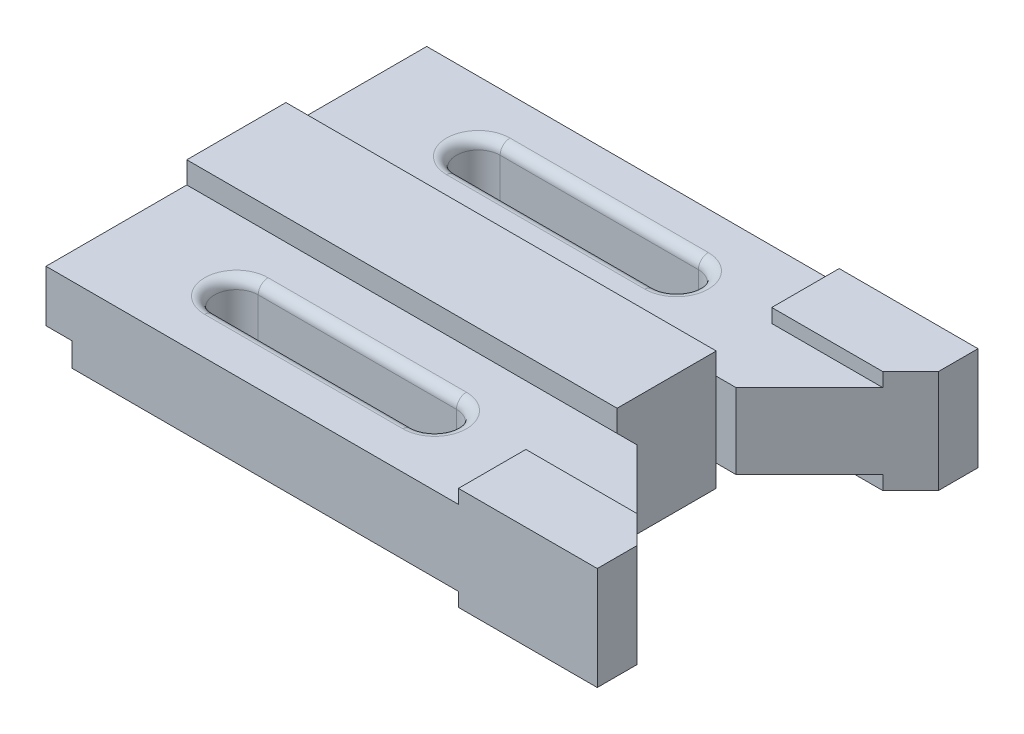
from build123d import *

# Parameters (mm, degrees)
ESQUISSE1_W                  = 108.5
ESQUISSE1_H                  = 25
BOSS_EXTRU_1_DEPTH           = 15
BOSS_EXTRU_2_DEPTH           = 9.5
BOSS_EXTRU_2_DEPTH_BACK      = 9.5
BOSS_EXTRU_3_DEPTH           = 13
ENL_V_MAT_EXTRU_1_DEPTH      = 120.587833829
ENL_V_MAT_EXTRU_1_DEPTH_BACK = 120.587833829
ESQUISSE2_W                  = 6.5
ESQUISSE2_H                  = 11.5
CONG_1_R                     = 2.5


with BuildPart() as part:
    # Esquisse1 → Boss.-Extru.1 (new, symmetric)
    with BuildSketch(Plane(origin=(0, 0, 0), x_dir=(1, 0, 0), z_dir=(0, 1, 0))):
        with Locations((-54.25, 0)):
            Rectangle(ESQUISSE1_W, ESQUISSE1_H)
    extrude(amount=BOSS_EXTRU_1_DEPTH, both=True)

    # Esquisse1<3> → Boss.-Extru.2 (add, two sides: drawn at the far end of the back side and taken through both)
    # profile 1 of 2: a face of its own
    with BuildSketch(Plane(origin=(0, 0, 0), x_dir=(1, 0, 0), z_dir=(0, 1, 0)).offset(-BOSS_EXTRU_2_DEPTH_BACK)):
        Polygon((5, -12.5), (0, -12.5), (-108.5, -12.5), (-108.5, -48), (-4.5, -48), (-4.5, -31), (23.5, -31), align=None)
        with BuildLine():
            Line((-28, -36), (-78, -36))
            ThreePointArc((-78, -36), (-83.5, -30.5), (-78, -25))
            Line((-78, -25), (-28, -25))
            ThreePointArc((-28, -25), (-22.5, -30.5), (-28, -36))
        make_face(mode=Mode.SUBTRACT)
    # profile 2 of 2: a face of its own
    with BuildSketch(Plane(origin=(0, 0, 0), x_dir=(1, 0, 0), z_dir=(0, 1, 0)).offset(-BOSS_EXTRU_2_DEPTH_BACK)):
        Polygon((-108.5, 12.5), (0, 12.5), (5, 12.5), (23.5, 31), (-4.5, 31), (-4.5, 48), (-108.5, 48), align=None)
        with BuildLine():
            ThreePointArc((-78, 25), (-83.5, 30.5), (-78, 36))
            Line((-78, 36), (-28, 36))
            ThreePointArc((-28, 36), (-22.5, 30.5), (-28, 25))
            Line((-28, 25), (-78, 25))
        make_face(mode=Mode.SUBTRACT)
    extrude(amount=BOSS_EXTRU_2_DEPTH + BOSS_EXTRU_2_DEPTH_BACK)

    # Esquisse1<4> → Boss.-Extru.3 (add, symmetric)
    with BuildSketch(Plane(origin=(0, 0, 0), x_dir=(1, 0, 0), z_dir=(0, 1, 0))):
        Polygon((-4.5, 31), (23.5, 31), (30.5, 38), (30.5, 48), (-4.5, 48), align=None)
        Polygon((30.5, -38), (23.5, -31), (-4.5, -31), (-4.5, -48), (30.5, -48), align=None)
    extrude(amount=BOSS_EXTRU_3_DEPTH, both=True)

    # Esquisse2 → Enlèv. mat.-Extru.1 (cut, two sides: drawn at the far end of the back side and taken through both)
    with BuildSketch(Plane.XY.offset(-ENL_V_MAT_EXTRU_1_DEPTH_BACK)):
        with Locations((-105.25, -9.25)):
            Rectangle(ESQUISSE2_W, ESQUISSE2_H)
    extrude(amount=ENL_V_MAT_EXTRU_1_DEPTH + ENL_V_MAT_EXTRU_1_DEPTH_BACK, mode=Mode.SUBTRACT)

    # Congé1
    cong_1_edges = [part.edges().sort_by_distance(p)[0] for p in [
        (-53, 9.5, 36),
        (-53, -9.5, 36),
        (-83.5, 9.5, 30.5),
        (-53, 9.5, 25),
        (-22.5, 9.5, 30.5),
        (-53, -9.5, 25),
        (-83.5, -9.5, 30.5),
        (-22.5, -9.5, 30.5),
        (-22.5, 9.5, -30.5),
        (-22.5, -9.5, -30.5),
        (-53, 9.5, -25),
        (-53, -9.5, -25),
        (-83.5, 9.5, -30.5),
        (-83.5, -9.5, -30.5),
        (-53, 9.5, -36),
        (-53, -9.5, -36),
    ]]
    fillet(cong_1_edges, radius=CONG_1_R)


solid = part.part
